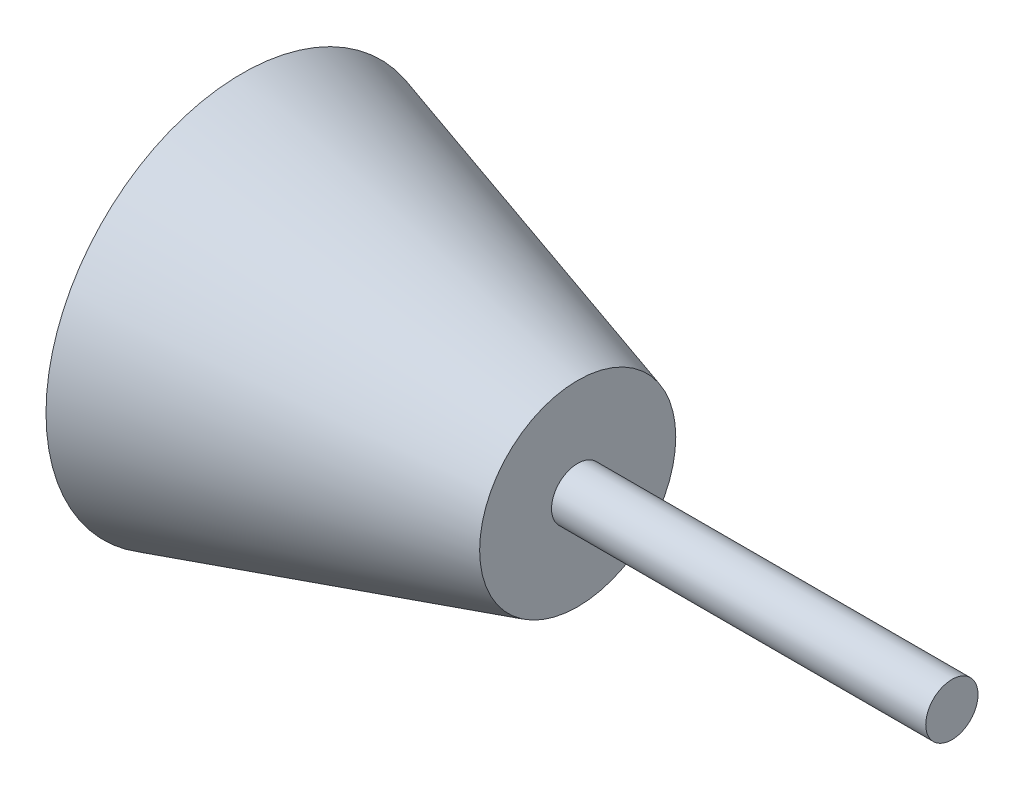
from build123d import *


with BuildPart() as part:
    # 草图1 → 旋转1 (revolve)
    with BuildSketch(Plane.XY, mode=Mode.PRIVATE) as revolve_1_sk:
        Polygon((525, 890), (525, 875), (550.662685476, 882.5), (550.662685476, 888), (579.279710513, 888), (579.279710513, 890), align=None)
    revolve(revolve_1_sk.sketch.rotate(Axis((525, 890, 0), (1, 0, 0)), 270), axis=Axis((525, 890, 0), (1, 0, 0)))


solid = part.part
